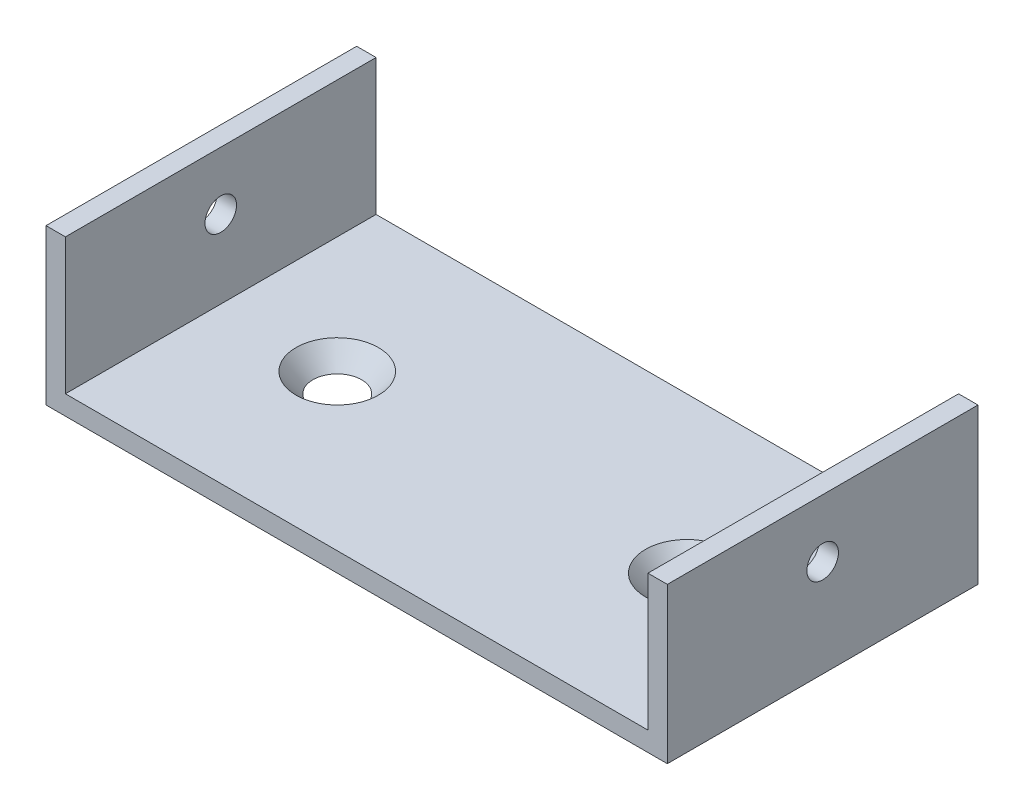
from build123d import *

# Parameters (mm, degrees)
BOSS_EXTRUDE2_DEPTH                  = 25.4
F_1_4_0_25_DIAMETER_HOLE1_AT_2_COUNT = 2
F_1_4_0_25_DIAMETER_HOLE1_AT_2_PITCH = 57.15
F_13_64_0_20313_DIAMETER_HOLE1_D     = 5.159502


with BuildPart() as part:
    # Sketch3 → Boss-Extrude2 (new, symmetric)
    with BuildSketch(Plane.XY):
        Polygon((-50.8, 12.7), (-50.8, -12.7), (50.8, -12.7), (50.8, 12.7), (47.625, 12.7), (47.625, -9.525), (-47.625, -9.525), (-47.625, 12.7), align=None)
    extrude(amount=BOSS_EXTRUDE2_DEPTH, both=True)

    # Sketch6 → 1/4 (0.25) Diameter Hole1 (revolve, cut)
    with BuildSketch(Plane(origin=(-28.575, -9.525, 0), x_dir=(0, 0, 1), z_dir=(1, 0, 0))):
        Polygon((0, 0), (0, 3.175), (3.175, 3.175), (3.175, 4.105319735), (6.7437, 0), align=None)
    f_1_4_0_25_diameter_hole1 = revolve(axis=Axis((-28.575, -3.175, 0), (0, -1, 0)), mode=Mode.SUBTRACT)

    # 1/4 (0.25) Diameter Hole1 at 2: 1/4 (0.25) Diameter Hole1 ×2
    with Locations(*[(i * F_1_4_0_25_DIAMETER_HOLE1_AT_2_PITCH, 0, 0) for i in range(1, F_1_4_0_25_DIAMETER_HOLE1_AT_2_COUNT)]):
        add(f_1_4_0_25_diameter_hole1, mode=Mode.SUBTRACT)

    # 13/64 (0.20313) Diameter Hole1 (through all)
    with Locations(Plane(origin=(50.8, 0, 0), x_dir=(0, 0, -1), z_dir=(1, 0, 0))):
        with Locations((0, 3.215843377)):
            Hole(F_13_64_0_20313_DIAMETER_HOLE1_D / 2)


solid = part.part
